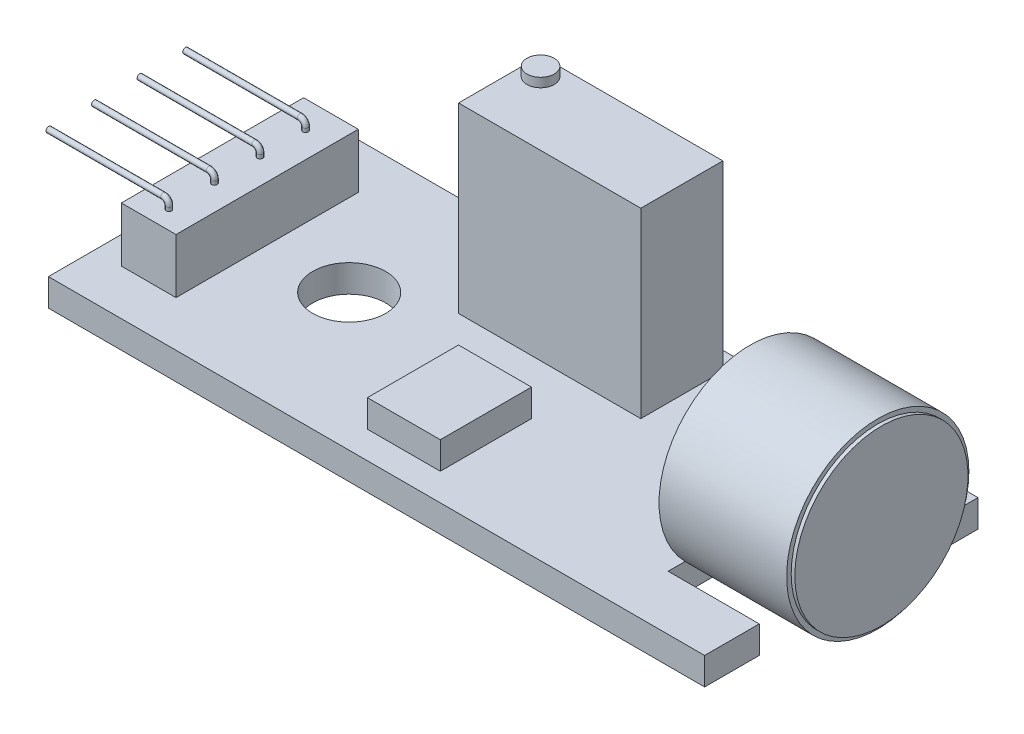
from build123d import *

# Parameters (mm, degrees)
SKETCH1_R           = 2
BOSS_EXTRUDE1_DEPTH = 1.5
SKETCH2_R           = 5
SKETCH2_R_2         = 4.75
BOSS_EXTRUDE2_DEPTH = 7
SKETCH3_R           = 4.75
BOSS_EXTRUDE3_DEPTH = 7.2
SKETCH4_W           = 10
SKETCH4_H           = 4.5
BOSS_EXTRUDE4_DEPTH = 10
SKETCH5_W           = 3
SKETCH5_H           = 10
BOSS_EXTRUDE5_DEPTH = 3
SKETCH6_W           = 4
SKETCH6_H           = 5
BOSS_EXTRUDE6_DEPTH = 1.5
SWEEP1_PROFILE_R    = 0.15
SWEEP2_PROFILE_R    = 0.15
LPATTERN1_COUNT     = 4
LPATTERN1_PITCH     = 2.5
SKETCH63_R          = 0.75
BOSS_EXTRUDE7_DEPTH = 0.5


with BuildPart() as part:
    # Sketch1 → Boss-Extrude1 (new body)
    with BuildSketch(Plane(origin=(0, 0, 0), x_dir=(1, 0, 0), z_dir=(0, 1, 0))):
        Polygon((18, 4.5), (13, 4.5), (13, -4.5), (18, -4.5), (18, -7.5), (-18, -7.5), (-18, 7.5), (18, 7.5), align=None)
        with Locations(Location((-9, 0, 0), (0, 0, 270))):
            Circle(SKETCH1_R, mode=Mode.SUBTRACT)
    extrude(amount=BOSS_EXTRUDE1_DEPTH)

    # Sketch2 → Boss-Extrude2 (add)
    with BuildSketch(Plane(origin=(13, 0, 0), x_dir=(0, 0, -1), z_dir=(1, 0, 0))):
        with Locations(Location((0, 5, 0), (0, 0, 224.427004001))):
            Circle(SKETCH2_R)
        with Locations(Location((0, 5, 0), (0, 0, 227.463101637))):
            Circle(SKETCH2_R_2, mode=Mode.SUBTRACT)
    extrude(amount=BOSS_EXTRUDE2_DEPTH)

    # Sketch3 → Boss-Extrude3 (add)
    with BuildSketch(Plane.ZY.offset(-13)):
        with Locations((0, 5)):
            Circle(SKETCH3_R)
    extrude(amount=-BOSS_EXTRUDE3_DEPTH)

    # Sketch4 → Boss-Extrude4 (add)
    with BuildSketch(Plane(origin=(0, 1.5, 0), x_dir=(1, 0, 0), z_dir=(0, 1, 0))):
        with Locations((0, 4.25)):
            Rectangle(SKETCH4_W, SKETCH4_H)
    extrude(amount=BOSS_EXTRUDE4_DEPTH)

    # Sketch5 → Boss-Extrude5 (add)
    with BuildSketch(Plane(origin=(0, 1.5, 0), x_dir=(1, 0, 0), z_dir=(0, 1, 0))):
        with Locations((-15, 0)):
            Rectangle(SKETCH5_W, SKETCH5_H)
    extrude(amount=BOSS_EXTRUDE5_DEPTH)

    # Sketch6 → Boss-Extrude6 (add)
    with BuildSketch(Plane(origin=(0, 1.5, 0), x_dir=(1, 0, 0), z_dir=(0, 1, 0))):
        with Locations((0, -3.5)):
            Rectangle(SKETCH6_W, SKETCH6_H)
    extrude(amount=BOSS_EXTRUDE6_DEPTH)

    # Sweep1: sweep along a curve in space
    with BuildLine() as sweep1_path:
        Line((13, 5.74066974, -1), (12.5, 5.74066974, -1))
        ThreePointArc((12.5, 5.74066974, -1), (11.792893219, 5.447776522, -1), (11.5, 4.74066974, -1))
        Line((11.5, 4.74066974, -1), (11.5, 1.5, -1))
    # Sweep1 profile (on start of the path) → Sweep1 (sweep)
    with BuildSketch(Plane(origin=(13, 5.74066974, -1), x_dir=(0, 0, -1), z_dir=(-1, 0, 0))):
        Circle(SWEEP1_PROFILE_R)
    sweep1 = sweep(path=sweep1_path.line)

    # Sweep2: sweep along a curve in space
    with BuildLine() as sweep2_path:
        Line((-14.891900492, 4.5, 4), (-14.891900492, 4.7, 4))
        ThreePointArc((-14.891900492, 4.7, 4), (-14.979768458, 4.912132034, 4), (-15.191900492, 5, 4))
        Line((-15.191900492, 5, 4), (-21.483222575, 5, 4))
    # Sweep2 profile (on start of the path) → Sweep2 (sweep)
    with BuildSketch(Plane(origin=(-14.891900492, 4.5, 4), x_dir=(0, 0, 1), z_dir=(0, 1, 0))):
        Circle(SWEEP2_PROFILE_R)
    sweep2 = sweep(path=sweep2_path.line)

    # LPattern1: Sweep2 ×4
    with Locations(*[(0, 0, -i * LPATTERN1_PITCH) for i in range(1, LPATTERN1_COUNT)]):
        add(sweep2)

    # Mirror1: Sweep1 across plane
    add(sweep1.mirror(Plane.XY))

    # Sketch63 → Boss-Extrude7 (add)
    with BuildSketch(Plane(origin=(0, 11.5, 0), x_dir=(1, 0, 0), z_dir=(0, 1, 0))):
        with Locations(Location((-4, 5.5, 0), (0, 0, 270))):
            Circle(SKETCH63_R)
    extrude(amount=BOSS_EXTRUDE7_DEPTH)


solid = part.part
